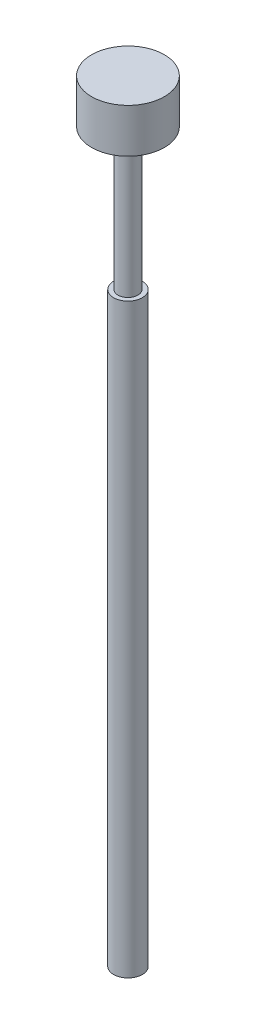
from build123d import *

# Parameters (mm, degrees)
SKETCH_2_R          = 0.65
EXTRUDE_1_DEPTH     = 33
CUT_EXTRUDE_START   = -6.4
SKETCH_3_R          = 0.65
SKETCH_3_R_2        = 0.45
CUT_EXTRUDE_2_DEPTH = 6.4
SKETCH_5_R          = 1.65
EXTRUDE_2_DEPTH     = 2


with BuildPart() as part:
    # 草图2 → 凸台-拉伸1 (new body)
    with BuildSketch(Plane(origin=(0, 0, 0), x_dir=(1, 0, 0), z_dir=(0, 1, 0))):
        with Locations(Location((0, 0, 0), (0, 0, 270))):
            Circle(SKETCH_2_R)
    extrude(amount=EXTRUDE_1_DEPTH)

    # 草图3 → 切除-拉伸2 (cut)
    with BuildSketch(Plane(origin=(0, 33, 0), x_dir=(1, 0, 0), z_dir=(0, 1, 0)).offset(CUT_EXTRUDE_START)):
        with Locations(Location((0, 0, 0), (0, 0, 270))):
            Circle(SKETCH_3_R)
        with Locations(Location((0, 0, 0), (0, 0, 270))):
            Circle(SKETCH_3_R_2, mode=Mode.SUBTRACT)
    extrude(amount=CUT_EXTRUDE_2_DEPTH, mode=Mode.SUBTRACT)

    # 草图5 → 凸台-拉伸2 (add)
    with BuildSketch(Plane(origin=(0, 33, 0), x_dir=(1, 0, 0), z_dir=(0, 1, 0))):
        with Locations(Location((0, 0, 0), (0, 0, 270))):
            Circle(SKETCH_5_R)
    extrude(amount=EXTRUDE_2_DEPTH)


solid = part.part
